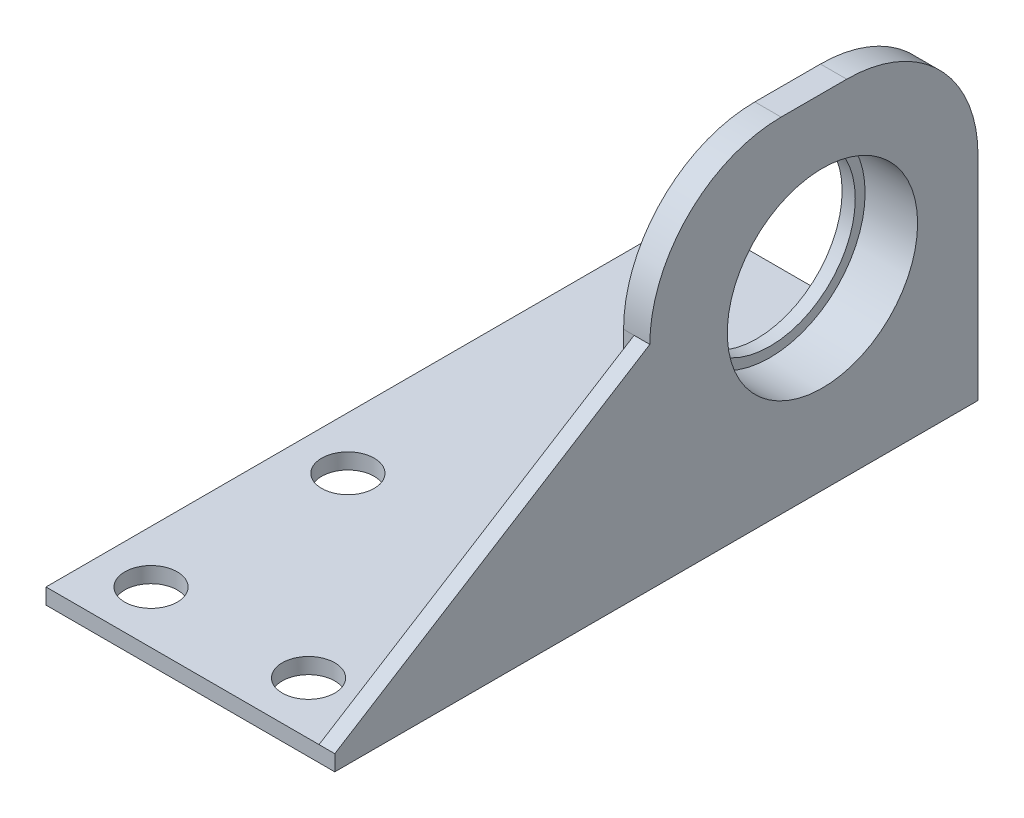
from build123d import *

# Parameters (mm, degrees)
SKETCH_1_W          = 49
SKETCH_1_H          = 1.2
EXTRUDE_1_DEPTH     = 22
CUT_EXTRUDE_1_REACH = 55.726
SKETCH_2_R          = 2
SKETCH_3_W          = 2
SKETCH_3_H          = 25
EXTRUDE_2_DEPTH     = 25
CUT_EXTRUDE_2_REACH = 61.762
SKETCH_4_R          = 7.25
SKETCH_5_R          = 8
SKETCH_5_R_2        = 7.25
EXTRUDE_3_DEPTH     = 3
EXTRUDE_START       = -1
SKETCH_6_R          = 8
SKETCH_6_R_2        = 6.5
EXTRUDE_4_DEPTH     = 1
EXTRUDE_5_REACH     = 60.107
SKETCH_7_W          = 2
SKETCH_7_H          = 6.3
FILLET_1_R          = 10
EXTRUDE_6_DEPTH     = 1.2


with BuildPart() as part:
    # 草图1 → 凸台-拉伸1 (new body)
    with BuildSketch(Plane(origin=(0, 0, 0), x_dir=(0, 0, -1), z_dir=(1, 0, 0))):
        with Locations((24.5, 0.6)):
            Rectangle(SKETCH_1_W, SKETCH_1_H)
    extrude(amount=EXTRUDE_1_DEPTH)

    # 草图2 → 切除-拉伸1 (cut, up to next)
    with BuildSketch(Plane(origin=(0, 1.2, 0), x_dir=(1, 0, 0), z_dir=(0, 1, 0)), mode=Mode.PRIVATE) as cut_extrude_1_sk1:
        with Locations(Location((16, 19, 0), (0, 0, 270))):
            Circle(SKETCH_2_R)
    cut_extrude_1_tool1 = extrude(cut_extrude_1_sk1.sketch, amount=-CUT_EXTRUDE_1_REACH, mode=Mode.PRIVATE) & part.part
    # 草图2 → 切除-拉伸1 (cut, up to next)
    with BuildSketch(Plane(origin=(0, 1.2, 0), x_dir=(1, 0, 0), z_dir=(0, 1, 0)), mode=Mode.PRIVATE) as cut_extrude_1_sk2:
        with Locations(Location((4, 19, 0), (0, 0, 270))):
            Circle(SKETCH_2_R)
    cut_extrude_1_tool2 = extrude(cut_extrude_1_sk2.sketch, amount=-CUT_EXTRUDE_1_REACH, mode=Mode.PRIVATE) & part.part
    # 草图2 → 切除-拉伸1 (cut, up to next)
    with BuildSketch(Plane(origin=(0, 1.2, 0), x_dir=(1, 0, 0), z_dir=(0, 1, 0)), mode=Mode.PRIVATE) as cut_extrude_1_sk3:
        with Locations(Location((4, 4, 0), (0, 0, 270))):
            Circle(SKETCH_2_R)
    cut_extrude_1_tool3 = extrude(cut_extrude_1_sk3.sketch, amount=-CUT_EXTRUDE_1_REACH, mode=Mode.PRIVATE) & part.part
    # 草图2 → 切除-拉伸1 (cut, up to next)
    with BuildSketch(Plane(origin=(0, 1.2, 0), x_dir=(1, 0, 0), z_dir=(0, 1, 0)), mode=Mode.PRIVATE) as cut_extrude_1_sk4:
        with Locations(Location((16, 4, 0), (0, 0, 270))):
            Circle(SKETCH_2_R)
    cut_extrude_1_tool4 = extrude(cut_extrude_1_sk4.sketch, amount=-CUT_EXTRUDE_1_REACH, mode=Mode.PRIVATE) & part.part
    add(cut_extrude_1_tool1.solids().sort_by_distance((16, 1.2, -19))[0], mode=Mode.SUBTRACT)
    add(cut_extrude_1_tool2.solids().sort_by_distance((4, 1.2, -19))[0], mode=Mode.SUBTRACT)
    add(cut_extrude_1_tool3.solids().sort_by_distance((4, 1.2, -4))[0], mode=Mode.SUBTRACT)
    add(cut_extrude_1_tool4.solids().sort_by_distance((16, 1.2, -4))[0], mode=Mode.SUBTRACT)

    # 草图3 → 凸台-拉伸2 (add)
    with BuildSketch(Plane(origin=(0, 1.2, 0), x_dir=(1, 0, 0), z_dir=(0, 1, 0))):
        with Locations((21, 36.5)):
            Rectangle(SKETCH_3_W, SKETCH_3_H)
    extrude(amount=EXTRUDE_2_DEPTH)

    # 草图4 → 切除-拉伸2 (cut, up to next)
    with BuildSketch(Plane(origin=(22, 0, 0), x_dir=(0, 0, -1), z_dir=(1, 0, 0)), mode=Mode.PRIVATE) as cut_extrude_2_sk1:
        with Locations((37.15, 14)):
            Circle(SKETCH_4_R)
    cut_extrude_2_tool1 = extrude(cut_extrude_2_sk1.sketch, amount=-CUT_EXTRUDE_2_REACH, mode=Mode.PRIVATE) & part.part
    add(cut_extrude_2_tool1.solids().sort_by_distance((22, 14, -37.15))[0], mode=Mode.SUBTRACT)

    # 草图5 → 凸台-拉伸3 (add)
    with BuildSketch(Plane.ZY.offset(-20)):
        with Locations(Location((-37.15, 14, 0), (0, 0, 180))):
            Circle(SKETCH_5_R)
        with Locations(Location((-37.15, 14, 0), (0, 0, 180))):
            Circle(SKETCH_5_R_2, mode=Mode.SUBTRACT)
    extrude(amount=EXTRUDE_3_DEPTH)

    # 草图6 → 凸台-拉伸4 (add)
    with BuildSketch(Plane.ZY.offset(-17).offset(EXTRUDE_START)):
        with Locations(Location((-37.15, 14, 0), (0, 0, 180))):
            Circle(SKETCH_6_R)
        with Locations((-37.15, 14)):
            Circle(SKETCH_6_R_2, mode=Mode.SUBTRACT)
    extrude(amount=EXTRUDE_4_DEPTH)

    # 草图7 → 凸台-拉伸5 (add, up to next)
    with BuildSketch(Plane.ZY.offset(-17), mode=Mode.PRIVATE) as extrude_5_sk1:
        with Locations((-37.15, 4.35)):
            Rectangle(SKETCH_7_W, SKETCH_7_H)
    extrude_5_tool1 = extrude(extrude_5_sk1.sketch, amount=-EXTRUDE_5_REACH, mode=Mode.PRIVATE) - part.part
    add(extrude_5_tool1.solids().sort_by_distance((17, 4.35, -37.15))[0])

    # 圆角1
    fillet_1_edges = [part.edges().sort_by_distance(p)[0] for p in [
        (21, 26.2, -24),
        (21, 26.2, -49),
    ]]
    fillet(fillet_1_edges, radius=FILLET_1_R)

    # 草图8 → 凸台-拉伸6 (add)
    with BuildSketch(Plane(origin=(22, 0, 0), x_dir=(0, 0, -1), z_dir=(1, 0, 0))):
        Polygon((0, 1.2), (24, 16.2), (24, 1.2), align=None)
    extrude(amount=-EXTRUDE_6_DEPTH)


solid = part.part
